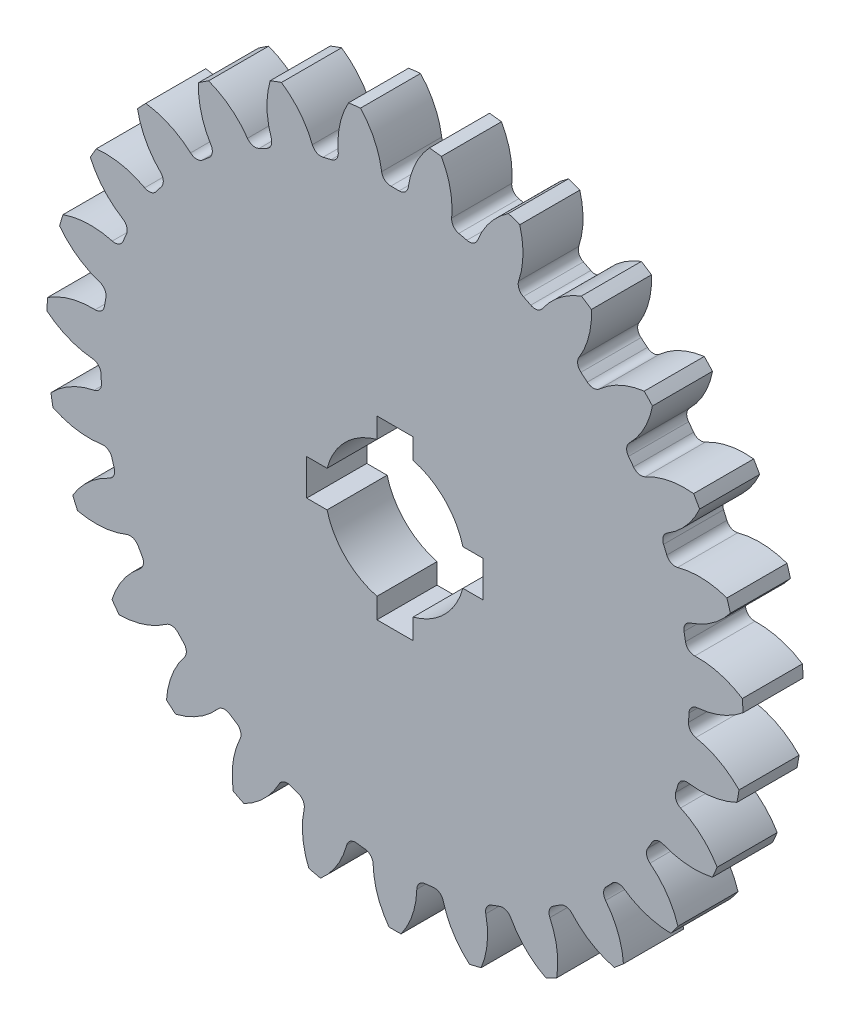
from build123d import *

# Parameters (mm, degrees)
SKETCH1_R                = 29
BOSS_EXTRUDE1_DEPTH      = 5
CUT_EXTRUDE1_DEPTH       = 10
FILLET2_R                = 0.76
CIRPATTERN2_COUNT        = 27
FILLET2_OF_CIRPATTERN2_R = 0.76
CUT_EXTRUDE2_DEPTH       = 5


with BuildPart() as part:
    # Sketch1 → Boss-Extrude1 (new body)
    with BuildSketch(Plane.XY):
        Circle(SKETCH1_R)
    extrude(amount=-BOSS_EXTRUDE1_DEPTH)

    # Sketch1<4> → Cut-Extrude1 (cut)
    with BuildSketch(Plane.XY):
        with BuildLine():
            ThreePointArc((-1.046314573, 24.477647473), (0, 24.5), (1.046314573, 24.477647473))
            ThreePointArc((1.046314573, 24.477647473), (1.568781937, 26.829662524), (2.869593384, 28.857675475))
            ThreePointArc((2.869593384, 28.857675475), (0, 29), (-2.869593384, 28.857675475))
            ThreePointArc((-2.869593384, 28.857675475), (-1.568781937, 26.829662524), (-1.046314573, 24.477647473))
        make_face()
    cut_extrude1 = extrude(amount=-CUT_EXTRUDE1_DEPTH, mode=Mode.SUBTRACT)

    # Fillet2
    fillet2_edges = [part.edges().sort_by_distance(p)[0] for p in [
        (1.046314573, 24.477647473, -2.5),
        (-1.046314573, 24.477647473, -2.5),
    ]]
    fillet(fillet2_edges, radius=FILLET2_R)

    # CirPattern2: Cut-Extrude1 ×27 about axis
    cirpattern2_axis = Axis((0, 0, 0), (0, 0, 1))
    for i in range(1, CIRPATTERN2_COUNT):
        add(cut_extrude1.rotate(cirpattern2_axis, i * 360 / CIRPATTERN2_COUNT), mode=Mode.SUBTRACT)

    # Fillet2 of CirPattern2
    fillet2_of_cirpattern2_edges = [part.edges().sort_by_distance(p)[0] for p in [
        (-4.626822958, 24.059146064, -2.5),
        (-6.663045014, 23.576552571, -2.5),
        (-10.050527265, 22.343609863, -2.5),
        (-11.920568973, 21.404439618, -2.5),
        (-14.932405046, 19.42352387, -2.5),
        (-16.535451974, 18.078407784, -2.5),
        (-19.009273006, 15.456310679, -2.5),
        (-20.258904479, 13.777764308, -2.5),
        (-22.061346137, 10.655843778, -2.5),
        (-22.890194199, 8.734357991, -2.5),
        (-23.924086388, 5.28091758, -2.5),
        (-24.287467626, 3.220080174, -2.5),
        (-24.497072949, -0.378704251, -2.5),
        (-24.375397386, -2.467792998, -2.5),
        (-23.749415967, -6.017910037, -2.5),
        (-23.149243163, -8.022626812, -2.5),
        (-21.721421823, -11.332688736, -2.5),
        (-20.67510725, -13.144958737, -2.5),
        (-18.522420206, -16.036519252, -2.5),
        (-17.086370954, -17.558642534, -2.5),
        (-14.324870121, -19.875816864, -2.5),
        (-12.576503976, -21.025735367, -2.5),
        (-9.35506258, -22.643604045, -2.5),
        (-7.388634414, -23.359325365, -2.5),
        (-3.880921194, -24.19066867, -2.5),
        (-1.802441658, -24.433608085, -2.5),
        (1.802441658, -24.433608085, -2.5),
        (3.880921194, -24.19066867, -2.5),
        (7.388634414, -23.359325365, -2.5),
        (9.35506258, -22.643604045, -2.5),
        (12.576503976, -21.025735367, -2.5),
        (14.324870121, -19.875816864, -2.5),
        (17.086370954, -17.558642534, -2.5),
        (18.522420206, -16.036519252, -2.5),
        (20.67510725, -13.144958737, -2.5),
        (21.721421823, -11.332688736, -2.5),
        (23.149243163, -8.022626812, -2.5),
        (23.749415967, -6.017910037, -2.5),
        (24.375397386, -2.467792998, -2.5),
        (24.497072949, -0.378704251, -2.5),
        (24.287467626, 3.220080174, -2.5),
        (23.924086388, 5.28091758, -2.5),
        (22.890194199, 8.734357991, -2.5),
        (22.061346137, 10.655843778, -2.5),
        (20.258904479, 13.777764308, -2.5),
        (19.009273006, 15.456310679, -2.5),
        (16.535451974, 18.078407784, -2.5),
        (14.932405046, 19.42352387, -2.5),
        (11.920568973, 21.404439618, -2.5),
        (10.050527265, 22.343609863, -2.5),
        (6.663045014, 23.576552571, -2.5),
        (4.626822958, 24.059146064, -2.5),
    ]]
    fillet(fillet2_of_cirpattern2_edges, radius=FILLET2_OF_CIRPATTERN2_R)

    # Sketch2 → Cut-Extrude2 (cut)
    with BuildSketch(Plane.XY):
        with BuildLine():
            Line((-1.5, 5.652839314), (-1.5, 7.348469228))
            Line((-1.5, 7.348469228), (1.5, 7.348469228))
            Line((1.5, 7.348469228), (1.5, 5.652839314))
            ThreePointArc((1.5, 5.652839314), (4.135492251, 4.135492251), (5.652839314, 1.5))
            Line((5.652839314, 1.5), (7.348469228, 1.5))
            Line((7.348469228, 1.5), (7.348469228, -1.5))
            Line((7.348469228, -1.5), (5.652839314, -1.5))
            ThreePointArc((5.652839314, -1.5), (4.135492251, -4.135492251), (1.5, -5.652839314))
            Line((1.5, -5.652839314), (1.5, -7.348469228))
            Line((1.5, -7.348469228), (-1.5, -7.348469228))
            Line((-1.5, -7.348469228), (-1.5, -5.652839314))
            ThreePointArc((-1.5, -5.652839314), (-4.135492251, -4.135492251), (-5.652839314, -1.5))
            Line((-5.652839314, -1.5), (-7.348469228, -1.5))
            Line((-7.348469228, -1.5), (-7.348469228, 1.5))
            Line((-7.348469228, 1.5), (-5.652839314, 1.5))
            ThreePointArc((-5.652839314, 1.5), (-4.135492251, 4.135492251), (-1.5, 5.652839314))
        make_face()
    extrude(amount=-CUT_EXTRUDE2_DEPTH, mode=Mode.SUBTRACT)


solid = part.part
